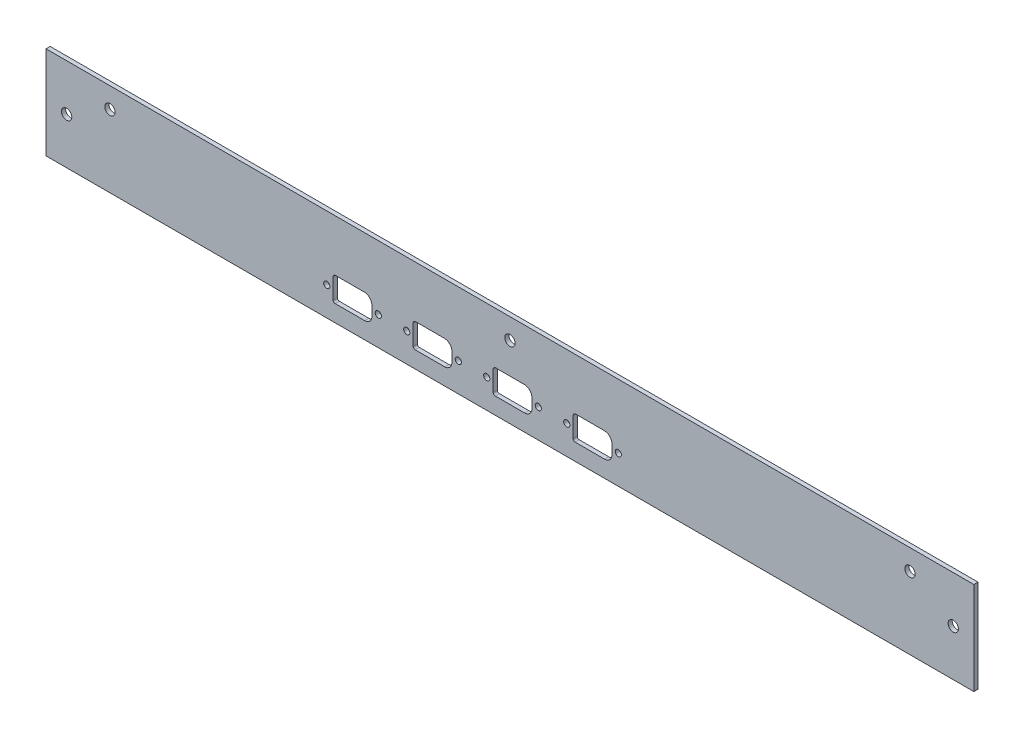
from build123d import *

# Parameters (mm, degrees)
SKETCH1_W           = 450
SKETCH1_H           = 45
BOSS_EXTRUDE1_DEPTH = 2
SKETCH2_R           = 1.5
CUT_EXTRUDE1_DEPTH  = 227.131046077
SKETCH3_R           = 2.5
CUT_EXTRUDE2_DEPTH  = 227.131046077


with BuildPart() as part:
    # Sketch1 → Boss-Extrude1 (new body)
    with BuildSketch(Plane.XY):
        Rectangle(SKETCH1_W, SKETCH1_H)
    extrude(amount=BOSS_EXTRUDE1_DEPTH)

    # Sketch2 → Cut-Extrude1 (cut, through all)
    with BuildSketch(Plane.XY.offset(2)):
        with Locations((-50.0375, -8.55)):
            Circle(SKETCH2_R)
        with Locations((-25.0375, -8.55)):
            Circle(SKETCH2_R)
        with Locations((-11.2375, -8.55)):
            Circle(SKETCH2_R)
        with Locations((13.7625, -8.55)):
            Circle(SKETCH2_R)
        with Locations((27.5625, -8.55)):
            Circle(SKETCH2_R)
        with Locations((52.5625, -8.55)):
            Circle(SKETCH2_R)
        with Locations((-88.8375, -8.55)):
            Circle(SKETCH2_R)
        with Locations((-63.8375, -8.55)):
            Circle(SKETCH2_R)
        with BuildLine():
            Line((-31.6625, -14.4), (-45.9375, -14.4))
            ThreePointArc((-45.9375, -14.4), (-46.644606781, -14.107106781), (-46.9375, -13.4))
            Line((-46.9375, -13.4), (-46.9375, -3.7))
            ThreePointArc((-46.9375, -3.7), (-46.586028137, -2.851471863), (-45.7375, -2.5))
            Line((-45.7375, -2.5), (-31.8625, -2.5))
            ThreePointArc((-31.8625, -2.5), (-29.22852724, -3.59102724), (-28.1375, -6.225))
            Line((-28.1375, -6.225), (-28.1375, -10.875))
            ThreePointArc((-28.1375, -10.875), (-29.169948596, -13.367551404), (-31.6625, -14.4))
        make_face()
        with BuildLine():
            Line((7.1375, -14.4), (-7.1375, -14.4))
            ThreePointArc((-7.1375, -14.4), (-7.844606781, -14.107106781), (-8.1375, -13.4))
            Line((-8.1375, -13.4), (-8.1375, -3.7))
            ThreePointArc((-8.1375, -3.7), (-7.786028137, -2.851471863), (-6.9375, -2.5))
            Line((-6.9375, -2.5), (6.9375, -2.5))
            ThreePointArc((6.9375, -2.5), (9.57147276, -3.59102724), (10.6625, -6.225))
            Line((10.6625, -6.225), (10.6625, -10.875))
            ThreePointArc((10.6625, -10.875), (9.630051404, -13.367551404), (7.1375, -14.4))
        make_face()
        with BuildLine():
            Line((45.9375, -14.4), (31.6625, -14.4))
            ThreePointArc((31.6625, -14.4), (30.955393219, -14.107106781), (30.6625, -13.4))
            Line((30.6625, -13.4), (30.6625, -3.7))
            ThreePointArc((30.6625, -3.7), (31.013971863, -2.851471863), (31.8625, -2.5))
            Line((31.8625, -2.5), (45.7375, -2.5))
            ThreePointArc((45.7375, -2.5), (48.37147276, -3.59102724), (49.4625, -6.225))
            Line((49.4625, -6.225), (49.4625, -10.875))
            ThreePointArc((49.4625, -10.875), (48.430051404, -13.367551404), (45.9375, -14.4))
        make_face()
        with BuildLine():
            Line((-70.4625, -14.4), (-84.7375, -14.4))
            ThreePointArc((-84.7375, -14.4), (-85.444606781, -14.107106781), (-85.7375, -13.4))
            Line((-85.7375, -13.4), (-85.7375, -3.7))
            ThreePointArc((-85.7375, -3.7), (-85.386028137, -2.851471863), (-84.5375, -2.5))
            Line((-84.5375, -2.5), (-70.6625, -2.5))
            ThreePointArc((-70.6625, -2.5), (-68.02852724, -3.59102724), (-66.9375, -6.225))
            Line((-66.9375, -6.225), (-66.9375, -10.875))
            ThreePointArc((-66.9375, -10.875), (-67.969948596, -13.367551404), (-70.4625, -14.4))
        make_face()
    extrude(amount=-CUT_EXTRUDE1_DEPTH, mode=Mode.SUBTRACT)

    # Sketch3 → Cut-Extrude2 (cut, through all)
    with BuildSketch(Plane.XY.offset(2)):
        with Locations((-215, 0)):
            Circle(SKETCH3_R)
        with Locations((215, 0)):
            Circle(SKETCH3_R)
        with Locations((-194, 12.495407459)):
            Circle(SKETCH3_R)
        with Locations((194, 12.495407459)):
            Circle(SKETCH3_R)
        with Locations((0, 12.5)):
            Circle(SKETCH3_R)
    extrude(amount=-CUT_EXTRUDE2_DEPTH, mode=Mode.SUBTRACT)


solid = part.part
